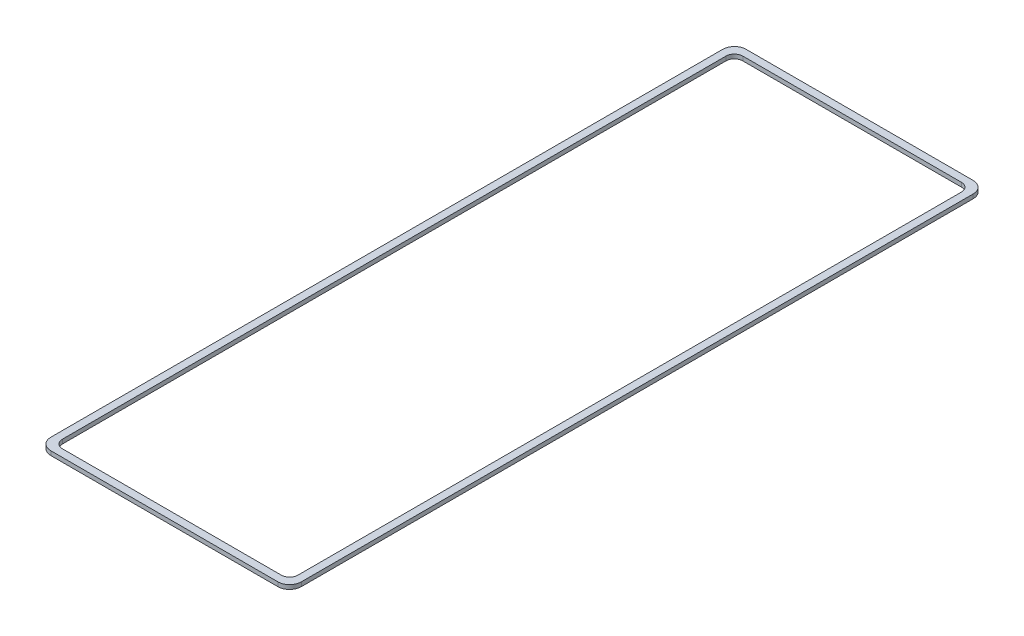
from build123d import *

# Parameters (mm, degrees)
SKETCH1_W           = 679.45
SKETCH1_H           = 1885.95
BOSS_EXTRUDE1_DEPTH = 11.43
SKETCH3_W           = 638.81
SKETCH3_H           = 1845.31
CUT_EXTRUDE2_DEPTH  = 1003.369977179
FILLET1_R           = 31.75
FILLET2_R           = 22.86


with BuildPart() as part:
    # Sketch1 → Boss-Extrude1 (new body)
    with BuildSketch(Plane(origin=(0, 0, 0), x_dir=(1, 0, 0), z_dir=(0, 1, 0))):
        Rectangle(SKETCH1_W, SKETCH1_H)
    extrude(amount=BOSS_EXTRUDE1_DEPTH)

    # Sketch3 → Cut-Extrude2 (cut, through all)
    with BuildSketch(Plane(origin=(0, 11.43, 0), x_dir=(1, 0, 0), z_dir=(0, 1, 0))):
        Rectangle(SKETCH3_W, SKETCH3_H)
    extrude(amount=-CUT_EXTRUDE2_DEPTH, mode=Mode.SUBTRACT)

    # Fillet1
    fillet1_edges = [part.edges().sort_by_distance(p)[0] for p in [
        (-339.725, 5.715, -942.975),
        (339.725, 5.715, -942.975),
        (339.725, 5.715, 942.975),
        (-339.725, 5.715, 942.975),
    ]]
    fillet(fillet1_edges, radius=FILLET1_R)

    # Fillet2
    fillet2_edges = [part.edges().sort_by_distance(p)[0] for p in [
        (-319.405, 5.715, -922.655),
        (319.405, 5.715, -922.655),
        (319.405, 5.715, 922.655),
        (-319.405, 5.715, 922.655),
    ]]
    fillet(fillet2_edges, radius=FILLET2_R)


solid = part.part
